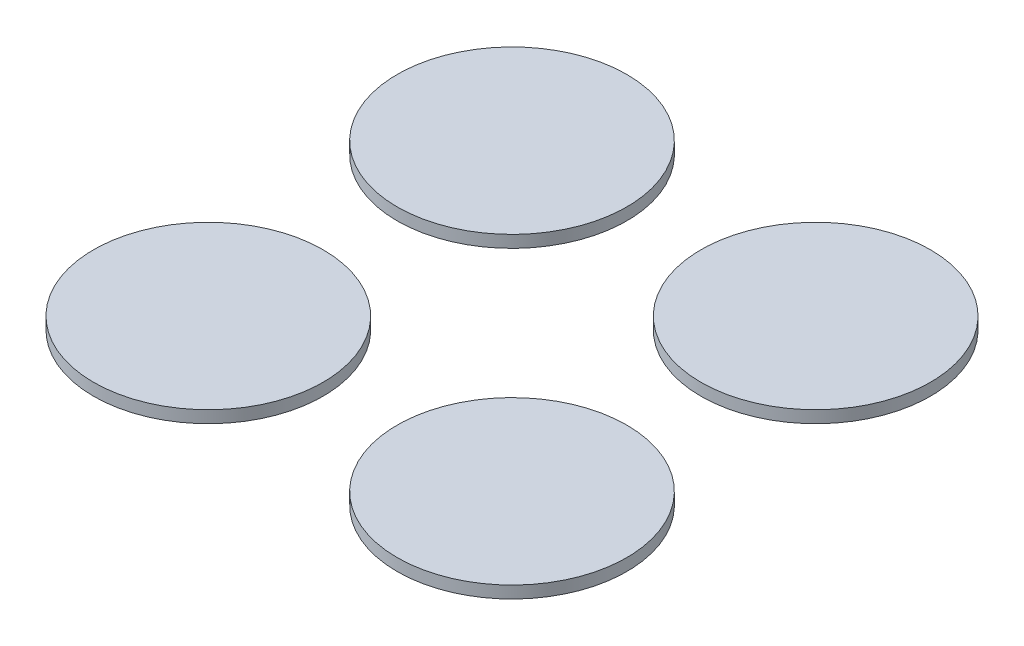
from build123d import *

# Parameters (mm, degrees)
SKETCH1_R             = 23.02
BOSS_EXTRUDE1_DEPTH   = 2.43
BOSS_EXTRUDE1_2_DEPTH = 2.43
BOSS_EXTRUDE1_3_DEPTH = 2.43
BOSS_EXTRUDE1_4_DEPTH = 2.43


with BuildPart() as part:
    # Sketch1 → Boss-Extrude1 (new body)
    with BuildSketch(Plane(origin=(0, 0, 0), x_dir=(1, 0, 0), z_dir=(0, 1, 0))):
        with Locations(Location((-30.445, 30.445, 0), (0, 0, 270))):
            Circle(SKETCH1_R)
    extrude(amount=BOSS_EXTRUDE1_DEPTH)


with BuildPart() as body_2:
    # Sketch1 → Boss-Extrude1 2 (new body)
    with BuildSketch(Plane(origin=(0, 0, 0), x_dir=(1, 0, 0), z_dir=(0, 1, 0))):
        with Locations(Location((30.445, 30.445, 0), (0, 0, 270))):
            Circle(SKETCH1_R)
    extrude(amount=BOSS_EXTRUDE1_2_DEPTH)


with BuildPart() as body_3:
    # Sketch1 → Boss-Extrude1 3 (new body)
    with BuildSketch(Plane(origin=(0, 0, 0), x_dir=(1, 0, 0), z_dir=(0, 1, 0))):
        with Locations(Location((30.445, -30.445, 0), (0, 0, 270))):
            Circle(SKETCH1_R)
    extrude(amount=BOSS_EXTRUDE1_3_DEPTH)


with BuildPart() as body_4:
    # Sketch1 → Boss-Extrude1 4 (new body)
    with BuildSketch(Plane(origin=(0, 0, 0), x_dir=(1, 0, 0), z_dir=(0, 1, 0))):
        with Locations(Location((-30.445, -30.445, 0), (0, 0, 270))):
            Circle(SKETCH1_R)
    extrude(amount=BOSS_EXTRUDE1_4_DEPTH)


solid = Compound([part.part, body_2.part, body_3.part, body_4.part])
